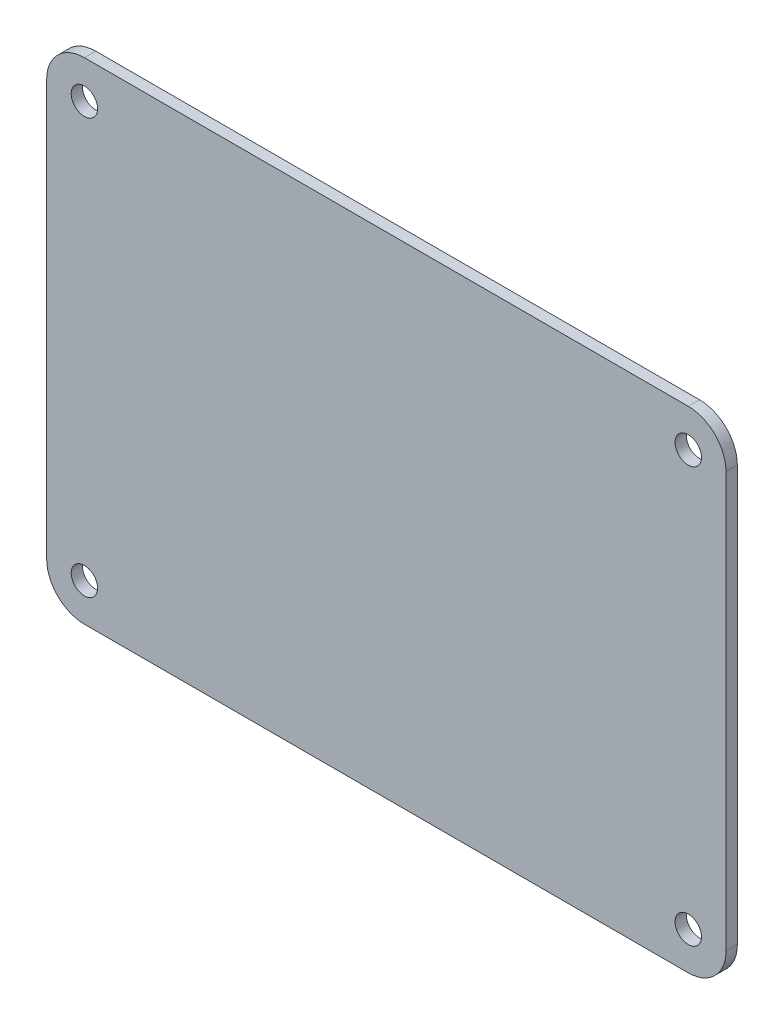
from build123d import *

# Parameters (mm, degrees)
SKETCH_1_W          = 180
SKETCH_1_H          = 130
EXTRUDE_1_DEPTH     = 3
FILLET_1_R          = 10
SKETCH_2_R          = 3.5
CUT_EXTRUDE_1_DEPTH = 112.05854312


with BuildPart() as part:
    # 草图1 → 凸台-拉伸1 (new body)
    with BuildSketch(Plane.XY):
        Rectangle(SKETCH_1_W, SKETCH_1_H)
    extrude(amount=EXTRUDE_1_DEPTH)

    # 圆角1
    fillet_1_edges = [part.edges().sort_by_distance(p)[0] for p in [
        (90, -65, 1.5),
        (-90, -65, 1.5),
        (-90, 65, 1.5),
        (90, 65, 1.5),
    ]]
    fillet(fillet_1_edges, radius=FILLET_1_R)

    # 草图2 → 切除-拉伸1 (cut, through all)
    with BuildSketch(Plane.XY.offset(3)):
        with Locations((-80, 55)):
            Circle(SKETCH_2_R)
        with Locations((-80, -55)):
            Circle(SKETCH_2_R)
        with Locations((80, 55)):
            Circle(SKETCH_2_R)
        with Locations((80, -55)):
            Circle(SKETCH_2_R)
    extrude(amount=-CUT_EXTRUDE_1_DEPTH, mode=Mode.SUBTRACT)


solid = part.part
